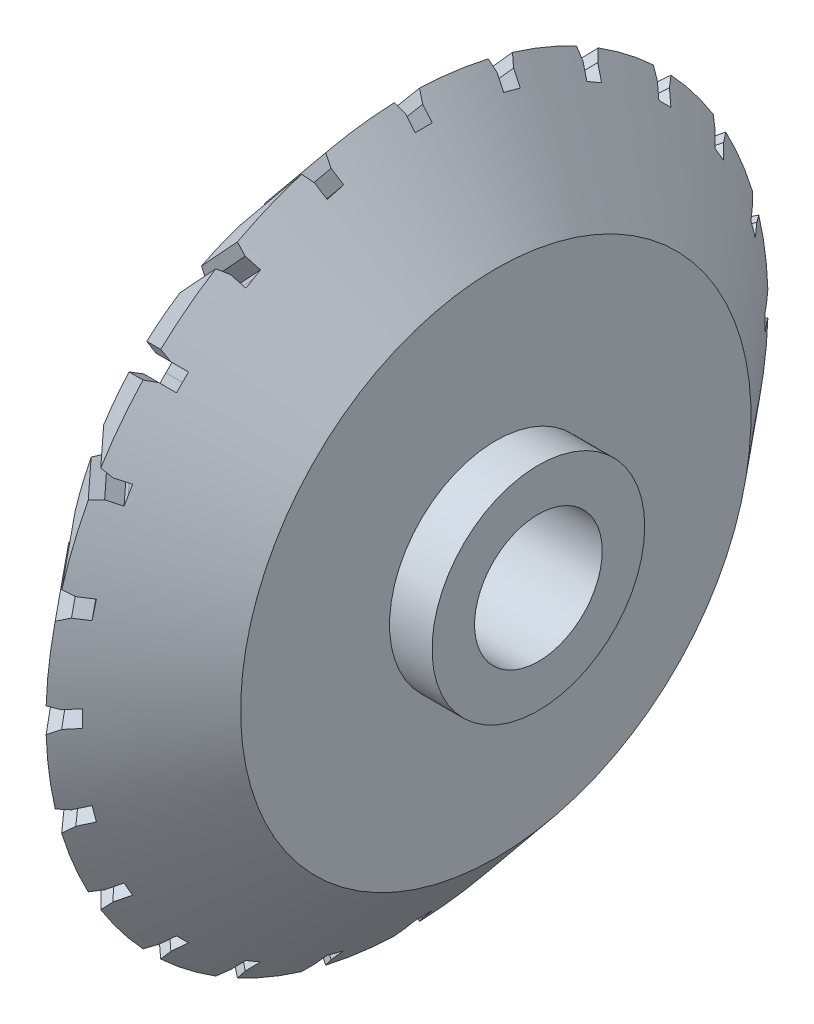
from build123d import *

# Parameters (mm, degrees)
CROQUIS6_R              = 500
SALIENTE_EXTRUIR2_DEPTH = 200
MATRIZC1_COUNT          = 24
CROQUIS23_R             = 800
CORTAR_EXTRUIR1_DEPTH   = 101
CROQUIS24_R             = 300
CORTAR_EXTRUIR2_DEPTH   = 1910


with BuildPart() as part:
    # Croquis1 → Revolución4 (revolve)
    with BuildSketch(Plane.XY, mode=Mode.PRIVATE) as revoluci_n4_sk:
        Polygon((0, 0), (0, 1200), (-417.811946296, 1697.928888027), (-835.623892592, 1200), (-835.623892592, 0), align=None)
    revolve(revoluci_n4_sk.sketch.rotate(Axis((-835.623892592, 0, 0), (1, 0, 0)), 180), axis=Axis((-835.623892592, 0, 0), (1, 0, 0)))

    # Croquis6 → Saliente-Extruir2 (add)
    with BuildSketch(Plane(origin=(0, 0, 0), x_dir=(0, 0, -1), z_dir=(1, 0, 0))):
        Circle(CROQUIS6_R)
    extrude(amount=SALIENTE_EXTRUIR2_DEPTH)

    # Cortar-Barrer3: sweep along a path in Croquis22
    with BuildLine(Plane(origin=(-1081.248881185, 907.275537414, 0), x_dir=(0, 0, 1), z_dir=(-0.7660444431189817, 0.6427876096865351, 0))) as cortar_barrer3_path:
        Line((0, 0), (0, 1032.124647226))
    # Croquis19 → Cortar-Barrer3 (sweep, cut)
    with BuildSketch(Plane(origin=(590.884651807, 495.8110934, 0), x_dir=(0, 0, -1), z_dir=(0.7660444431189771, 0.6427876096865406, 0))):
        Polygon((-58.811107883, 1568.4728666), (-40, 1516.789772456), (-40, 1446.789772456), (0, 1446.789772456), (40, 1446.789772456), (40, 1516.789772456), (58.811107883, 1568.4728666), (66.558214514, 1589.757867135), (-70.805906412, 1589.757867135), align=None)
    cortar_barrer3 = sweep(path=cortar_barrer3_path.line, mode=Mode.SUBTRACT)

    # MatrizC1: Cortar-Barrer3 ×24 about axis
    matrizc1_axis = Axis((0, 0, 0), (1, 0, 0))
    for i in range(1, MATRIZC1_COUNT):
        add(cortar_barrer3.rotate(matrizc1_axis, i * 360 / MATRIZC1_COUNT), mode=Mode.SUBTRACT)

    # Croquis23 → Cortar-Extruir1 (cut)
    with BuildSketch(Plane.ZY.offset(835.623892592)):
        with Locations(Location((0, 0, 0), (0, 0, 270))):
            Circle(CROQUIS23_R)
    extrude(amount=-CORTAR_EXTRUIR1_DEPTH, mode=Mode.SUBTRACT)

    # Croquis24 → Cortar-Extruir2 (cut)
    with BuildSketch(Plane(origin=(200, 0, 0), x_dir=(0, 0, -1), z_dir=(1, 0, 0))):
        Circle(CROQUIS24_R)
    extrude(amount=-CORTAR_EXTRUIR2_DEPTH, mode=Mode.SUBTRACT)


solid = part.part
